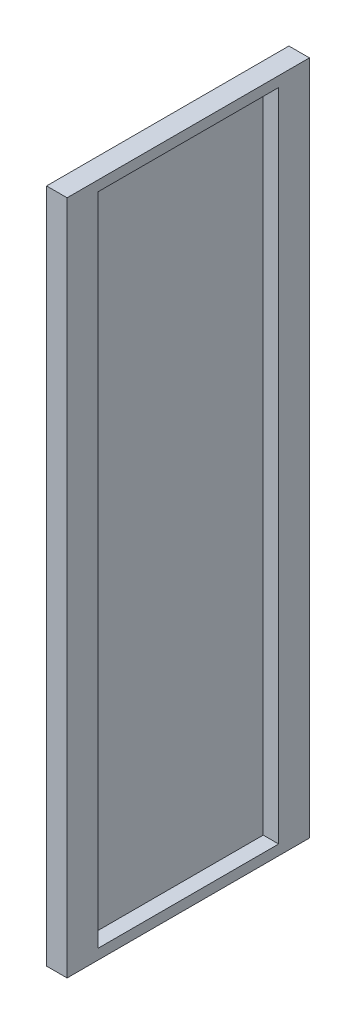
from build123d import *

# Parameters (mm, degrees)
SKETCH1_W           = 25.4
SKETCH1_H           = 299.72
BOSS_EXTRUDE1_DEPTH = 417.83
SKETCH2_W           = 223.52
SKETCH2_H           = 810.26
CUT_EXTRUDE1_DEPTH  = 19.05
SKETCH3_W           = 25.4
SKETCH3_H           = 118.11
CUT_EXTRUDE2_DEPTH  = 12.7


with BuildPart() as part:
    # Sketch1 → Boss-Extrude1 (new, symmetric)
    with BuildSketch(Plane(origin=(0, 0, 0), x_dir=(1, 0, 0), z_dir=(0, 1, 0))):
        Rectangle(SKETCH1_W, SKETCH1_H)
    extrude(amount=BOSS_EXTRUDE1_DEPTH, both=True)

    # Sketch2 → Cut-Extrude1 (cut)
    with BuildSketch(Plane(origin=(12.7, 0, 0), x_dir=(0, 0, -1), z_dir=(1, 0, 0))):
        Rectangle(SKETCH2_W, SKETCH2_H)
    extrude(amount=-CUT_EXTRUDE1_DEPTH, mode=Mode.SUBTRACT)

    # Sketch3 → Cut-Extrude2 (cut)
    with BuildSketch(Plane.ZY.offset(12.7)):
        with Locations((-130.81, 231.775)):
            Rectangle(SKETCH3_W, SKETCH3_H)
    extrude(amount=-CUT_EXTRUDE2_DEPTH, mode=Mode.SUBTRACT)


solid = part.part
